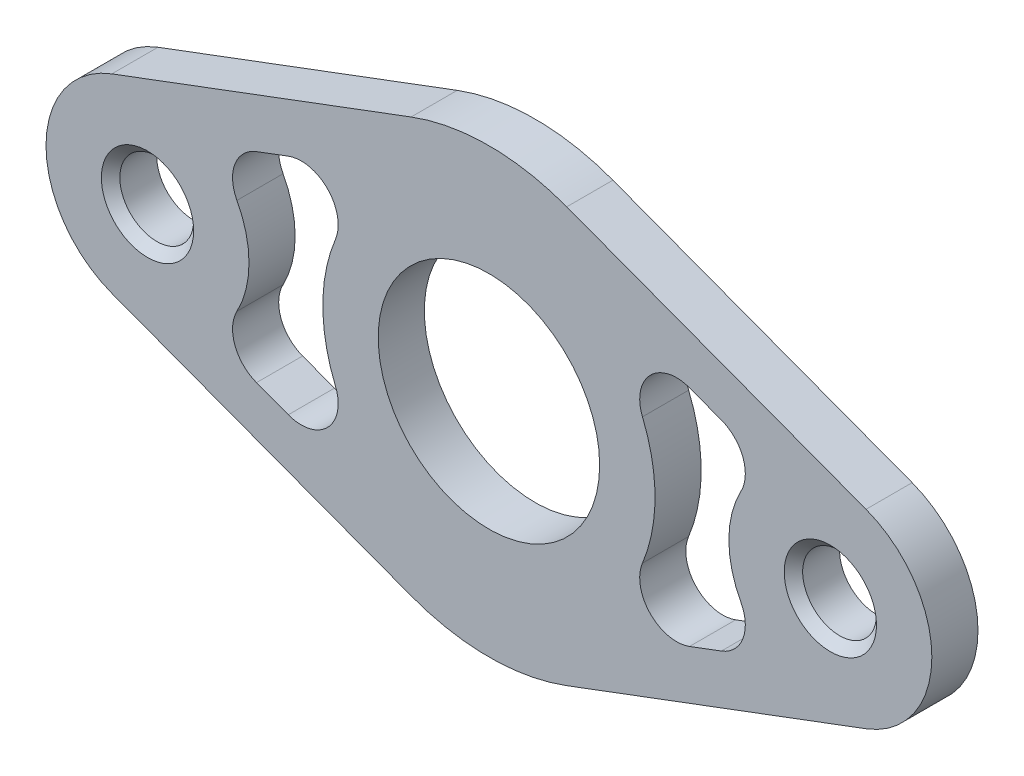
from build123d import *

# Parameters (mm, degrees)
SKETCH1_R           = 4
SKETCH1_R_2         = 12
BOSS_EXTRUDE1_DEPTH = 5
CUT_EXTRUDE1_REACH  = 55.898
CHAMFER1_SIZE       = 1


with BuildPart() as part:
    # Sketch1 → Boss-Extrude1 (new body)
    with BuildSketch(Plane.XY):
        with BuildLine():
            Line((-40.864864865, 10.298680477), (-8.432432432, 22.469848314))
            ThreePointArc((-8.432432432, 22.469848314), (0, 24), (8.432432432, 22.469848314))
            Line((8.432432432, 22.469848314), (40.864864865, 10.298680477))
            ThreePointArc((40.864864865, 10.298680477), (48, 0), (40.864864865, -10.298680477))
            Line((40.864864865, -10.298680477), (8.432432432, -22.469848314))
            ThreePointArc((8.432432432, -22.469848314), (0, -24), (-8.432432432, -22.469848314))
            Line((-8.432432432, -22.469848314), (-40.864864865, -10.298680477))
            ThreePointArc((-40.864864865, -10.298680477), (-48, 0), (-40.864864865, 10.298680477))
        make_face()
        with Locations((-37, 0)):
            Circle(SKETCH1_R, mode=Mode.SUBTRACT)
        with Locations((37, 0)):
            Circle(SKETCH1_R, mode=Mode.SUBTRACT)
        Circle(SKETCH1_R_2, mode=Mode.SUBTRACT)
    extrude(amount=BOSS_EXTRUDE1_DEPTH)

    # Sketch2 → Cut-Extrude1 (cut, up to next)
    with BuildSketch(Plane.XY.offset(5), mode=Mode.PRIVATE) as cut_extrude1_sk1:
        with BuildLine():
            Line((21.743091746, 12.134165045), (25.1898452, 10.840675422))
            ThreePointArc((25.1898452, 10.840675422), (27.528705446, 8.50299411), (27.308589183, 5.203513849))
            ThreePointArc((27.308589183, 5.203513849), (26, 0), (27.308589183, -5.203513849))
            ThreePointArc((27.308589183, -5.203513849), (27.528705446, -8.50299411), (25.1898452, -10.840675422))
            Line((25.1898452, -10.840675422), (21.743091746, -12.134165045))
            ThreePointArc((21.743091746, -12.134165045), (17.464066334, -11.171690651), (16.639925188, -6.863882994))
            ThreePointArc((16.639925188, -6.863882994), (18, 0), (16.639925188, 6.863882994))
            ThreePointArc((16.639925188, 6.863882994), (17.464066334, 11.171690651), (21.743091746, 12.134165045))
        make_face()
    cut_extrude1_tool1 = extrude(cut_extrude1_sk1.sketch, amount=-CUT_EXTRUDE1_REACH, mode=Mode.PRIVATE) & part.part
    # Sketch2 → Cut-Extrude1 (cut, up to next)
    with BuildSketch(Plane.XY.offset(5), mode=Mode.PRIVATE) as cut_extrude1_sk2:
        with BuildLine():
            Line((-21.743091746, -12.134165045), (-25.1898452, -10.840675422))
            ThreePointArc((-25.1898452, -10.840675422), (-27.528705446, -8.50299411), (-27.308589183, -5.203513849))
            ThreePointArc((-27.308589183, -5.203513849), (-26, 0), (-27.308589183, 5.203513849))
            ThreePointArc((-27.308589183, 5.203513849), (-27.528705446, 8.50299411), (-25.1898452, 10.840675422))
            Line((-25.1898452, 10.840675422), (-21.743091746, 12.134165045))
            ThreePointArc((-21.743091746, 12.134165045), (-17.464066334, 11.171690651), (-16.639925188, 6.863882994))
            ThreePointArc((-16.639925188, 6.863882994), (-18, 0), (-16.639925188, -6.863882994))
            ThreePointArc((-16.639925188, -6.863882994), (-17.464066334, -11.171690651), (-21.743091746, -12.134165045))
        make_face()
    cut_extrude1_tool2 = extrude(cut_extrude1_sk2.sketch, amount=-CUT_EXTRUDE1_REACH, mode=Mode.PRIVATE) & part.part
    add(cut_extrude1_tool1.solids().sort_by_distance((21.936549, 0, 5))[0], mode=Mode.SUBTRACT)
    add(cut_extrude1_tool2.solids().sort_by_distance((-21.936549, 0, 5))[0], mode=Mode.SUBTRACT)

    # Chamfer1
    chamfer1_edges = [part.edges().sort_by_distance(p)[0] for p in [
        (33, 0, 5),
        (-41, 0, 5),
    ]]
    chamfer(chamfer1_edges, length=CHAMFER1_SIZE)


solid = part.part
